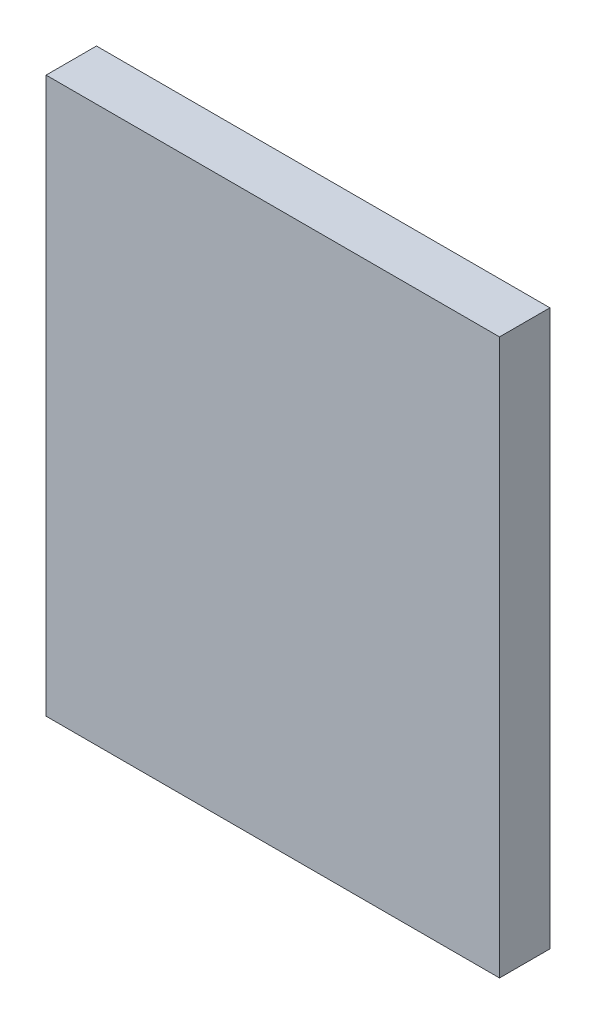
from build123d import *

# Parameters (mm, degrees)
SKETCH1_W           = 228.6
SKETCH1_H           = 279.908
BOSS_EXTRUDE1_DEPTH = 12.7


with BuildPart() as part:
    # Sketch1 → Boss-Extrude1 (new, symmetric)
    with BuildSketch(Plane.XY):
        with Locations((114.3, 139.954)):
            Rectangle(SKETCH1_W, SKETCH1_H)
    extrude(amount=BOSS_EXTRUDE1_DEPTH, both=True)


solid = part.part
